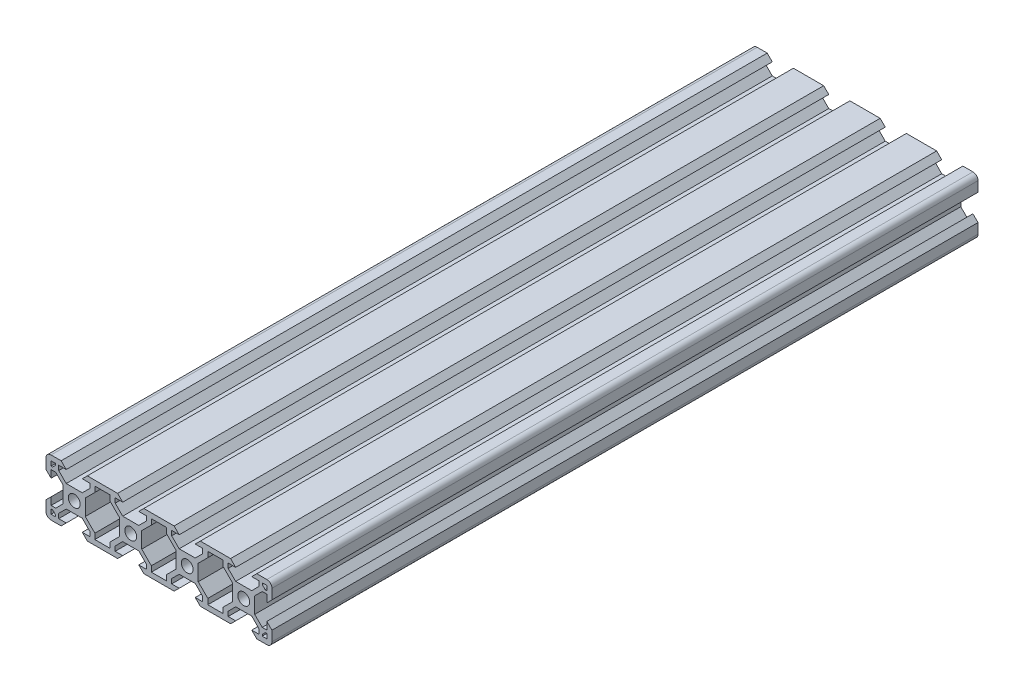
from build123d import *

# Parameters (mm, degrees)
ESQUISSE1_R        = 2.1
BOSS_EXTRU_1_DEPTH = 125


with BuildPart() as part:
    # Esquisse1 → Boss.-Extru.1 (new, symmetric)
    with BuildSketch(Plane.XY):
        with BuildLine():
            Line((-38.199999929, 10), (-34.639999675, 10))
            Line((-34.639999675, 10), (-32.839999603, 8.2))
            Line((-32.839999603, 8.2), (-35.499339671, 8.2))
            Line((-35.499339671, 8.2), (-35.499339671, 6.56))
            Line((-35.499339671, 6.56), (-32.839999603, 3.900660038))
            Line((-32.839999603, 3.900660038), (-27.159999603, 3.900660038))
            Line((-27.159999603, 3.900660038), (-24.500659536, 6.56))
            Line((-24.500659536, 6.56), (-24.500659536, 8.2))
            Line((-24.500659536, 8.2), (-27.159999603, 8.2))
            Line((-27.159999603, 8.2), (-25.359999532, 10))
            Line((-25.359999532, 10), (-14.640000468, 10))
            Line((-14.640000468, 10), (-12.840000397, 8.2))
            Line((-12.840000397, 8.2), (-15.499340464, 8.2))
            Line((-15.499340464, 8.2), (-15.499340464, 6.56))
            Line((-15.499340464, 6.56), (-12.840000397, 3.900660038))
            Line((-12.840000397, 3.900660038), (-7.159998809, 3.900660038))
            Line((-7.159998809, 3.900660038), (-4.500658742, 6.56))
            Line((-4.500658742, 6.56), (-4.500658742, 8.2))
            Line((-4.500658742, 8.2), (-7.159998809, 8.2))
            Line((-7.159998809, 8.2), (-5.359998738, 10))
            Line((-5.359998738, 10), (5.359998738, 10))
            Line((5.359998738, 10), (7.159998809, 8.2))
            Line((7.159998809, 8.2), (4.500658742, 8.2))
            Line((4.500658742, 8.2), (4.500658742, 6.56))
            Line((4.500658742, 6.56), (7.159998809, 3.900660038))
            Line((7.159998809, 3.900660038), (12.840000397, 3.900660038))
            Line((12.840000397, 3.900660038), (15.499340464, 6.56))
            Line((15.499340464, 6.56), (15.499340464, 8.2))
            Line((15.499340464, 8.2), (12.840000397, 8.2))
            Line((12.840000397, 8.2), (14.640000468, 10))
            Line((14.640000468, 10), (25.359999532, 10))
            Line((25.359999532, 10), (27.159999603, 8.2))
            Line((27.159999603, 8.2), (24.500659536, 8.2))
            Line((24.500659536, 8.2), (24.500659536, 6.56))
            Line((24.500659536, 6.56), (27.159999603, 3.900660038))
            Line((27.159999603, 3.900660038), (32.839999603, 3.900660038))
            Line((32.839999603, 3.900660038), (35.499339671, 6.56))
            Line((35.499339671, 6.56), (35.499339671, 8.2))
            Line((35.499339671, 8.2), (32.839999603, 8.2))
            Line((32.839999603, 8.2), (34.639999675, 10))
            Line((34.639999675, 10), (38.199999929, 10))
            ThreePointArc((38.199999929, 10), (39.47279216, 9.472792181), (39.999999929, 8.199999929))
            Line((39.999999929, 8.199999929), (39.999999787, 4.639999675))
            Line((39.999999787, 4.639999675), (38.199999716, 2.839999675))
            Line((38.199999716, 2.839999675), (38.199999821, 5.499339742))
            Line((38.199999821, 5.499339742), (36.559999821, 5.499339807))
            Line((36.559999821, 5.499339807), (33.900659754, 2.839999845))
            Line((33.900659754, 2.839999845), (33.900659641, 0))
            Line((33.900659641, 0), (33.900659754, -2.839999845))
            Line((33.900659754, -2.839999845), (36.559999821, -5.499339807))
            Line((36.559999821, -5.499339807), (38.199999821, -5.499339742))
            Line((38.199999821, -5.499339742), (38.199999716, -2.839999675))
            Line((38.199999716, -2.839999675), (39.999999787, -4.639999675))
            Line((39.999999787, -4.639999675), (39.999999929, -8.199999929))
            ThreePointArc((39.999999929, -8.199999929), (39.47279216, -9.472792181), (38.199999929, -10))
            Line((38.199999929, -10), (34.639999675, -10))
            Line((34.639999675, -10), (32.839999603, -8.2))
            Line((32.839999603, -8.2), (35.499339671, -8.2))
            Line((35.499339671, -8.2), (35.499339671, -6.56))
            Line((35.499339671, -6.56), (32.839999603, -3.900660038))
            Line((32.839999603, -3.900660038), (27.159999603, -3.900660038))
            Line((27.159999603, -3.900660038), (24.500659536, -6.56))
            Line((24.500659536, -6.56), (24.500659536, -8.2))
            Line((24.500659536, -8.2), (27.159999603, -8.2))
            Line((27.159999603, -8.2), (25.359999532, -10))
            Line((25.359999532, -10), (14.640000468, -10))
            Line((14.640000468, -10), (12.840000397, -8.2))
            Line((12.840000397, -8.2), (15.499340464, -8.2))
            Line((15.499340464, -8.2), (15.499340464, -6.56))
            Line((15.499340464, -6.56), (12.840000397, -3.900660038))
            Line((12.840000397, -3.900660038), (7.159998809, -3.900660038))
            Line((7.159998809, -3.900660038), (4.500658742, -6.56))
            Line((4.500658742, -6.56), (4.500658742, -8.2))
            Line((4.500658742, -8.2), (7.159998809, -8.2))
            Line((7.159998809, -8.2), (5.359998738, -10))
            Line((5.359998738, -10), (-5.359998738, -10))
            Line((-5.359998738, -10), (-7.159998809, -8.2))
            Line((-7.159998809, -8.2), (-4.500658742, -8.2))
            Line((-4.500658742, -8.2), (-4.500658742, -6.56))
            Line((-4.500658742, -6.56), (-7.159998809, -3.900660038))
            Line((-7.159998809, -3.900660038), (-12.840000397, -3.900660038))
            Line((-12.840000397, -3.900660038), (-15.499340464, -6.56))
            Line((-15.499340464, -6.56), (-15.499340464, -8.2))
            Line((-15.499340464, -8.2), (-12.840000397, -8.2))
            Line((-12.840000397, -8.2), (-14.640000468, -10))
            Line((-14.640000468, -10), (-25.359999532, -10))
            Line((-25.359999532, -10), (-27.159999603, -8.2))
            Line((-27.159999603, -8.2), (-24.500659536, -8.2))
            Line((-24.500659536, -8.2), (-24.500659536, -6.56))
            Line((-24.500659536, -6.56), (-27.159999603, -3.900660038))
            Line((-27.159999603, -3.900660038), (-32.839999603, -3.900660038))
            Line((-32.839999603, -3.900660038), (-35.499339671, -6.56))
            Line((-35.499339671, -6.56), (-35.499339671, -8.2))
            Line((-35.499339671, -8.2), (-32.839999603, -8.2))
            Line((-32.839999603, -8.2), (-34.639999675, -10))
            Line((-34.639999675, -10), (-38.199999929, -10))
            ThreePointArc((-38.199999929, -10), (-39.47279216, -9.472792181), (-39.999999929, -8.199999929))
            Line((-39.999999929, -8.199999929), (-39.999999787, -4.639999675))
            Line((-39.999999787, -4.639999675), (-38.199999716, -2.839999675))
            Line((-38.199999716, -2.839999675), (-38.199999821, -5.499339742))
            Line((-38.199999821, -5.499339742), (-36.559999821, -5.499339807))
            Line((-36.559999821, -5.499339807), (-33.900659754, -2.839999845))
            Line((-33.900659754, -2.839999845), (-33.900659641, 0))
            Line((-33.900659641, 0), (-33.900659754, 2.839999845))
            Line((-33.900659754, 2.839999845), (-36.559999821, 5.499339807))
            Line((-36.559999821, 5.499339807), (-38.199999821, 5.499339742))
            Line((-38.199999821, 5.499339742), (-38.199999716, 2.839999675))
            Line((-38.199999716, 2.839999675), (-39.999999787, 4.639999675))
            Line((-39.999999787, 4.639999675), (-39.999999929, 8.199999929))
            ThreePointArc((-39.999999929, 8.199999929), (-39.47279216, 9.472792181), (-38.199999929, 10))
        make_face()
        with Locations((-29.999999603, 0)):
            Circle(ESQUISSE1_R, mode=Mode.SUBTRACT)
        with Locations((-9.999999603, 0)):
            Circle(ESQUISSE1_R, mode=Mode.SUBTRACT)
        with Locations(Location((29.999999603, 0, 0), (0, 0, 180))):
            Circle(ESQUISSE1_R, mode=Mode.SUBTRACT)
        with Locations(Location((9.999999603, 0, 0), (0, 0, 180))):
            Circle(ESQUISSE1_R, mode=Mode.SUBTRACT)
        Polygon((-38.199999929, 8.2), (-38.199999864, 6.569339742), (-37.629999799, 6.569339742), (-36.569339648, 7.629999935), (-36.569339648, 8.2), align=None, mode=Mode.SUBTRACT)
        Polygon((-17.3, 6.239339079), (-17.3, 8.2), (-22.7, 8.2), (-22.7, 6.239339079), (-26.099339368, 2.839999845), (-26.099339368, -2.839999845), (-22.7, -6.239339079), (-22.7, -8.2), (-17.3, -8.2), (-17.3, -6.239339079), (-13.900660632, -2.839999845), (-13.900660632, 2.839999845), align=None, mode=Mode.SUBTRACT)
        Polygon((-6.099339678, -2.840000949), (-6.099339678, 2.840000949), (-2.700001413, 6.239339079), (-2.700001413, 8.2), (2.700001413, 8.2), (2.700001413, 6.239339079), (6.099339678, 2.840000949), (6.099339678, -2.840000949), (2.700001413, -6.239339079), (2.700001413, -8.2), (-2.700001413, -8.2), (-2.700001413, -6.239339079), align=None, mode=Mode.SUBTRACT)
        Polygon((-36.569339648, -7.629999935), (-36.569339648, -8.2), (-38.199999929, -8.2), (-38.199999864, -6.569339742), (-37.629999799, -6.569339742), align=None, mode=Mode.SUBTRACT)
        Polygon((36.569339648, 8.2), (38.199999929, 8.2), (38.199999864, 6.569339742), (37.629999799, 6.569339742), (36.569339648, 7.629999935), align=None, mode=Mode.SUBTRACT)
        Polygon((36.569339648, -8.2), (38.199999929, -8.2), (38.199999864, -6.569339742), (37.629999799, -6.569339742), (36.569339648, -7.629999935), align=None, mode=Mode.SUBTRACT)
        Polygon((13.900660632, -2.839999845), (17.3, -6.239339079), (17.3, -8.2), (22.7, -8.2), (22.7, -6.239339079), (26.099339368, -2.839999845), (26.099339368, 2.839999845), (22.7, 6.239339079), (22.7, 8.2), (17.3, 8.2), (17.3, 6.239339079), (13.900660632, 2.839999845), align=None, mode=Mode.SUBTRACT)
    extrude(amount=BOSS_EXTRU_1_DEPTH, both=True)


solid = part.part
